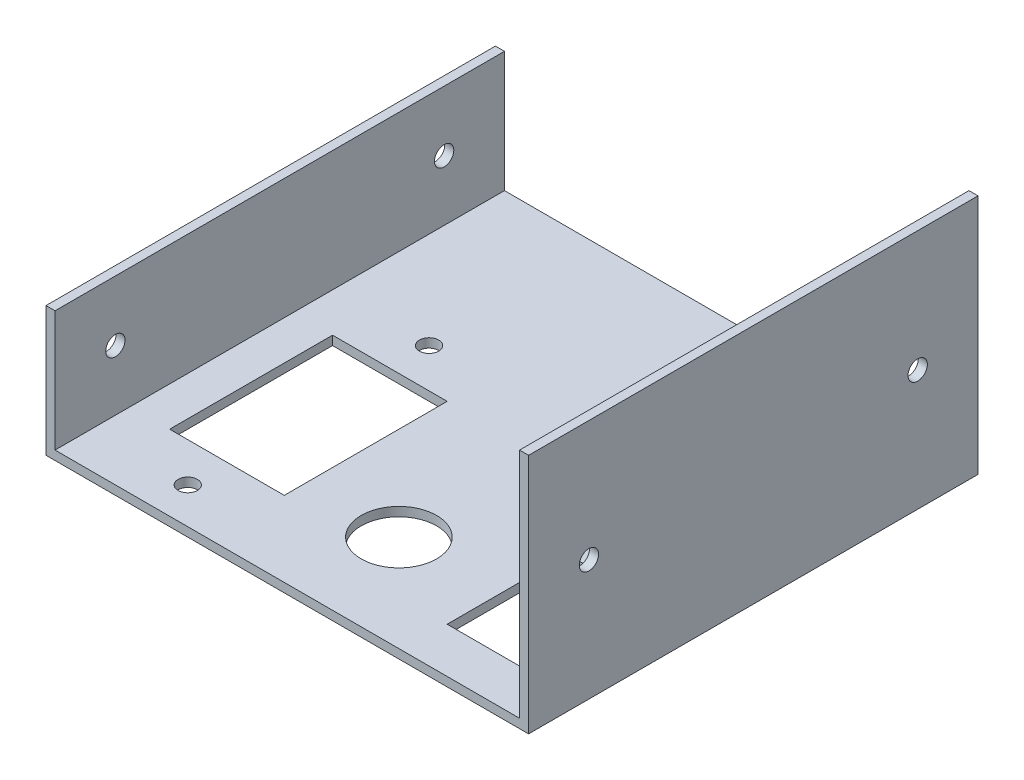
from build123d import *

# Parameters (mm, degrees)
SKETCH1_W           = 80
SKETCH1_H           = 74.5
BOSS_EXTRUDE1_DEPTH = 1.5
SKETCH2_W           = 1.5
SKETCH2_H           = 74.5
BOSS_EXTRUDE2_DEPTH = 20
SKETCH3_W           = 1.5
SKETCH3_H           = 74.5
BOSS_EXTRUDE3_DEPTH = 38.5
SKETCH4_R           = 1.6
SKETCH4_R_2         = 6.25
SKETCH4_W           = 19
SKETCH4_H           = 27
SKETCH4_W_2         = 12
SKETCH4_H_2         = 20
CUT_EXTRUDE1_DEPTH  = 40
SKETCH5_R           = 1.6
CUT_EXTRUDE2_DEPTH  = 40
SKETCH6_R           = 1.6
CUT_EXTRUDE3_DEPTH  = 40


with BuildPart() as part:
    # Sketch1 → Boss-Extrude1 (new body)
    with BuildSketch(Plane(origin=(0, 0, 0), x_dir=(1, 0, 0), z_dir=(0, 1, 0))):
        Rectangle(SKETCH1_W, SKETCH1_H)
    extrude(amount=BOSS_EXTRUDE1_DEPTH)

    # Sketch2 → Boss-Extrude2 (add)
    with BuildSketch(Plane(origin=(0, 1.5, 0), x_dir=(1, 0, 0), z_dir=(0, 1, 0))):
        with Locations((-39.25, 0)):
            Rectangle(SKETCH2_W, SKETCH2_H)
    extrude(amount=BOSS_EXTRUDE2_DEPTH)

    # Sketch3 → Boss-Extrude3 (add)
    with BuildSketch(Plane(origin=(0, 1.5, 0), x_dir=(1, 0, 0), z_dir=(0, 1, 0))):
        with Locations((39.25, 0)):
            Rectangle(SKETCH3_W, SKETCH3_H)
    extrude(amount=BOSS_EXTRUDE3_DEPTH)

    # Sketch4 → Cut-Extrude1 (cut)
    with BuildSketch(Plane(origin=(0, 1.5, 0), x_dir=(1, 0, 0), z_dir=(0, 1, 0))):
        with Locations(Location((-22.5, 8.75, 0), (0, 0, 270))):
            Circle(SKETCH4_R)
        with Locations(Location((-22.5, -31.25, 0), (0, 0, 270))):
            Circle(SKETCH4_R)
        with Locations(Location((2.5, -21.25, 0), (0, 0, 270))):
            Circle(SKETCH4_R_2)
        with Locations((-22.5, -11.25)):
            Rectangle(SKETCH4_W, SKETCH4_H)
        with Locations((25, -19.75)):
            Rectangle(SKETCH4_W_2, SKETCH4_H_2)
    extrude(amount=-CUT_EXTRUDE1_DEPTH, mode=Mode.SUBTRACT)

    # Sketch5 → Cut-Extrude2 (cut)
    with BuildSketch(Plane.ZY.offset(40)):
        with Locations((27.25, 11.5)):
            Circle(SKETCH5_R)
        with Locations((-27.25, 11.5)):
            Circle(SKETCH5_R)
    extrude(amount=-CUT_EXTRUDE2_DEPTH, mode=Mode.SUBTRACT)

    # Sketch6 → Cut-Extrude3 (cut)
    with BuildSketch(Plane(origin=(40, 0, 0), x_dir=(0, 0, -1), z_dir=(1, 0, 0))):
        with Locations((-27.25, 20)):
            Circle(SKETCH6_R)
        with Locations((27.25, 20)):
            Circle(SKETCH6_R)
    extrude(amount=-CUT_EXTRUDE3_DEPTH, mode=Mode.SUBTRACT)


solid = part.part
